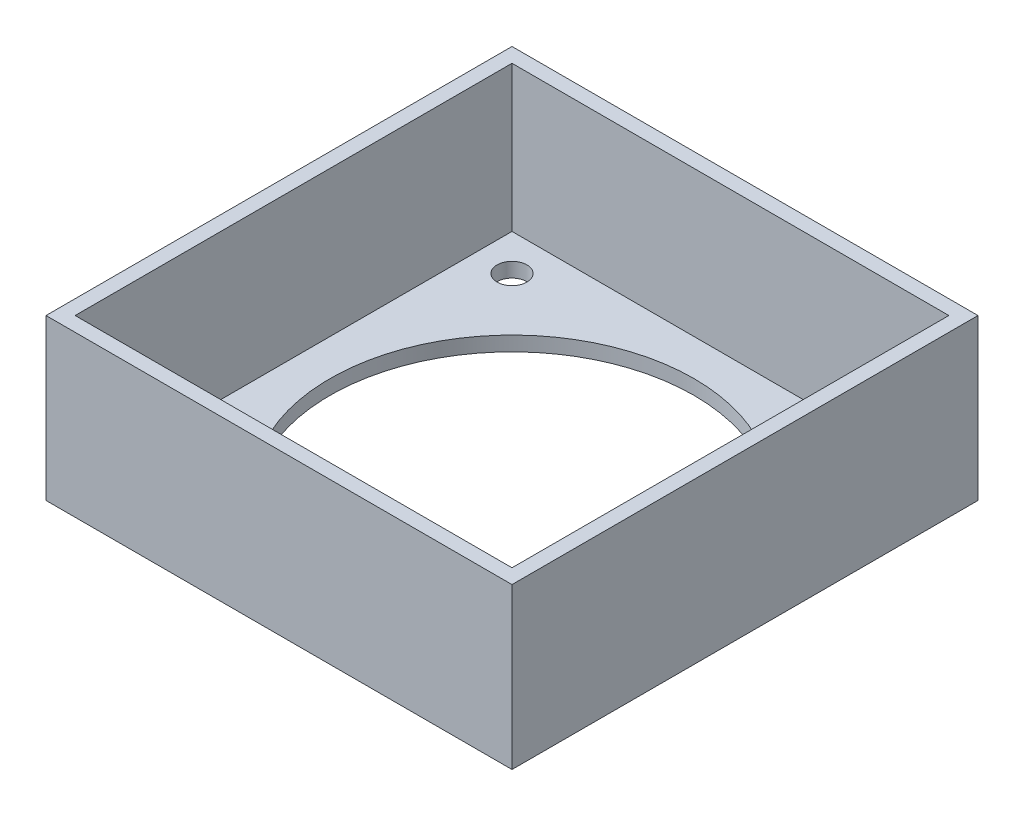
from build123d import *

# Parameters (mm, degrees)
SKETCH_1_W          = 64
SKETCH_1_H          = 64
EXTRUDE_1_DEPTH     = 22
SHELL_1_T           = -2
SKETCH_2_R          = 25
CUT_EXTRUDE_1_DEPTH = 22
SKETCH_3_R          = 2.05
CUT_EXTRUDE_2_DEPTH = 22


with BuildPart() as part:
    # 草图1 → 凸台-拉伸1 (new body)
    with BuildSketch(Plane(origin=(0, 0, 0), x_dir=(1, 0, 0), z_dir=(0, 1, 0))):
        with Locations((-2.874704492, -9.985815603)):
            Rectangle(SKETCH_1_W, SKETCH_1_H)
    extrude(amount=EXTRUDE_1_DEPTH)

    # 抽壳1
    shell_1_openings = [part.faces().sort_by_distance(p)[0] for p in [
        (-2.874704492, 22, 9.985815603),
    ]]
    offset(amount=SHELL_1_T, openings=shell_1_openings, kind=Kind.INTERSECTION)

    # 草图2 → 切除-拉伸1 (cut)
    with BuildSketch(Plane(origin=(0, 2, 0), x_dir=(1, 0, 0), z_dir=(0, 1, 0))):
        with Locations(Location((-2.874704492, -9.985815603, 0), (0, 0, 270))):
            Circle(SKETCH_2_R)
    extrude(amount=-CUT_EXTRUDE_1_DEPTH, mode=Mode.SUBTRACT)

    # 草图3 → 切除-拉伸2 (cut)
    with BuildSketch(Plane(origin=(0, 2, 0), x_dir=(1, 0, 0), z_dir=(0, 1, 0))):
        with Locations(Location((-27.874704492, 15.014184397, 0), (0, 0, 270))):
            Circle(SKETCH_3_R)
        with Locations(Location((22.125295508, 15.014184397, 0), (0, 0, 270))):
            Circle(SKETCH_3_R)
        with Locations(Location((-27.874704492, -34.985815603, 0), (0, 0, 270))):
            Circle(SKETCH_3_R)
        with Locations(Location((22.125295508, -34.985815603, 0), (0, 0, 270))):
            Circle(SKETCH_3_R)
    extrude(amount=-CUT_EXTRUDE_2_DEPTH, mode=Mode.SUBTRACT)


solid = part.part
